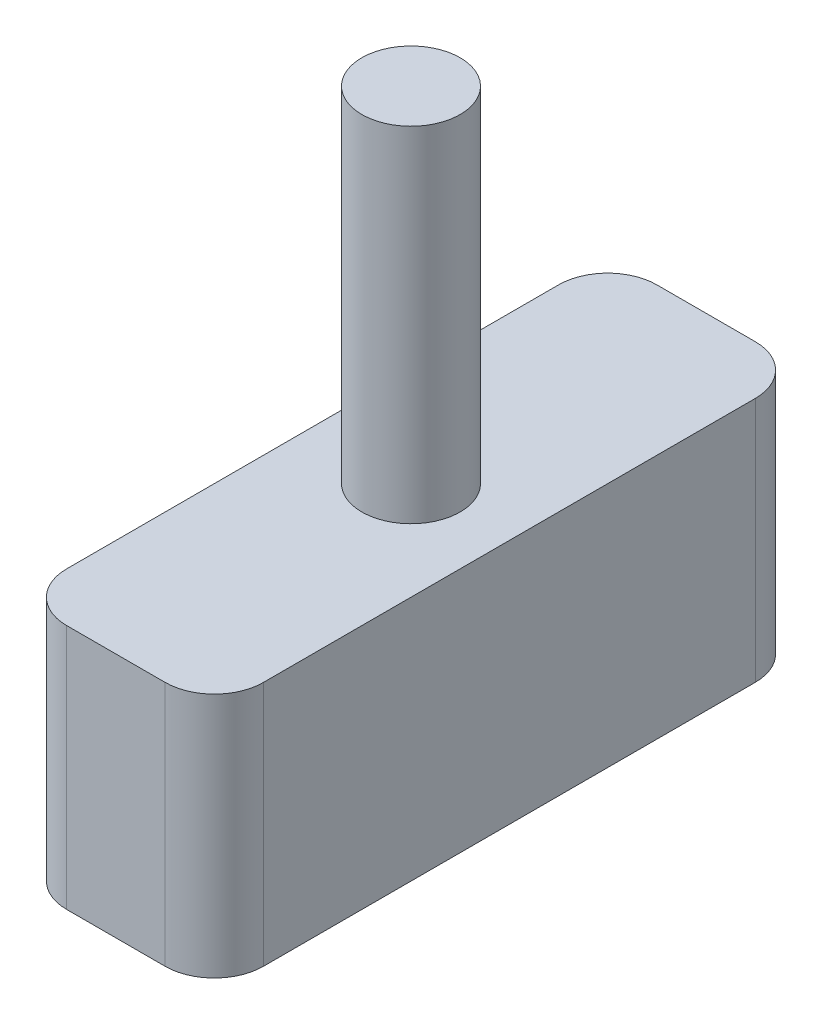
from build123d import *

# Parameters (mm, degrees)
SKETCH1_W           = 1
SKETCH1_H           = 7
BOSS_EXTRUDE1_DEPTH = 5


with BuildPart() as part:
    # Sketch1 → Revolve1 (revolve)
    with BuildSketch(Plane.XY, mode=Mode.PRIVATE) as revolve1_sk:
        with Locations((0.5, 3.5)):
            Rectangle(SKETCH1_W, SKETCH1_H)
    revolve(revolve1_sk.sketch.rotate(Axis((0, 7, 0), (0, -1, 0)), 180), axis=Axis((0, 7, 0), (0, -1, 0)))

    # Sketch2 → Boss-Extrude1 (add)
    with BuildSketch(Plane.XZ):
        with BuildLine():
            Line((1, -6), (-1, -6))
            ThreePointArc((-1, -6), (-1.707106781, -5.707106781), (-2, -5))
            Line((-2, -5), (-2, 5))
            ThreePointArc((-2, 5), (-1.707106781, 5.707106781), (-1, 6))
            Line((-1, 6), (1, 6))
            ThreePointArc((1, 6), (1.707106781, 5.707106781), (2, 5))
            Line((2, 5), (2, -5))
            ThreePointArc((2, -5), (1.707106781, -5.707106781), (1, -6))
        make_face()
    extrude(amount=BOSS_EXTRUDE1_DEPTH)


solid = part.part
